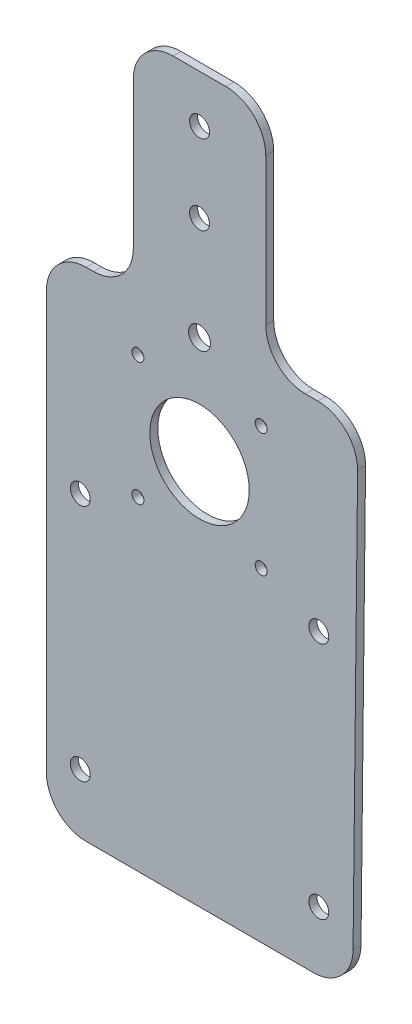
from build123d import *

# Parameters (mm, degrees)
SKETCH1_W           = 117
SKETCH1_H           = 200
BOSS_EXTRUDE1_DEPTH = 2
CUT_EXTRUDE1_DEPTH  = 2
SKETCH3_R           = 2.5
SKETCH3_R_2         = 1.5
SKETCH3_R_3         = 12.5
SKETCH3_R_4         = 2.75
CUT_EXTRUDE2_DEPTH  = 30
FILLET1_R           = 20
CUT_EXTRUDE3_DEPTH  = 10
FILLET2_R           = 10
CUT_EXTRUDE4_DEPTH  = 10
FILLET3_R           = 10
CUT_EXTRUDE5_DEPTH  = 10
FILLET4_R           = 10


with BuildPart() as part:
    # Sketch1 → Boss-Extrude1 (new body)
    with BuildSketch(Plane.XY):
        with Locations((58.5, 100)):
            Rectangle(SKETCH1_W, SKETCH1_H)
    extrude(amount=BOSS_EXTRUDE1_DEPTH)

    # Sketch2 → Cut-Extrude1 (cut)
    with BuildSketch(Plane.XY.offset(2)):
        Polygon((0, 120), (40, 200), (0, 200), align=None)
        Polygon((77, 200), (117, 120), (117, 200), align=None)
    extrude(amount=-CUT_EXTRUDE1_DEPTH, mode=Mode.SUBTRACT)

    # Sketch3 → Cut-Extrude2 (cut)
    with BuildSketch(Plane.XY.offset(2)):
        with Locations((58.5, 170)):
            Circle(SKETCH3_R)
        with Locations((58.5, 150)):
            Circle(SKETCH3_R)
        with Locations((28.5, 15)):
            Circle(SKETCH3_R)
        with Locations((88.5, 15)):
            Circle(SKETCH3_R)
        with Locations((28.5, 75)):
            Circle(SKETCH3_R)
        with Locations((88.5, 75)):
            Circle(SKETCH3_R)
        with Locations((43, 112.5)):
            Circle(SKETCH3_R_2)
        with Locations((43, 81.5)):
            Circle(SKETCH3_R_2)
        with Locations((74, 81.5)):
            Circle(SKETCH3_R_2)
        with Locations((74, 112.5)):
            Circle(SKETCH3_R_2)
        with Locations((58.5, 97)):
            Circle(SKETCH3_R_3)
        with Locations((58.5, 124)):
            Circle(SKETCH3_R_4)
    extrude(amount=-CUT_EXTRUDE2_DEPTH, mode=Mode.SUBTRACT)

    # Fillet1
    fillet1_edges = [part.edges().sort_by_distance(p)[0] for p in [
        (0, 120, 1),
        (40, 200, 1),
        (117, 120, 1),
        (77, 200, 1),
        (117, 0, 1),
        (0, 0, 1),
    ]]
    fillet(fillet1_edges, radius=FILLET1_R)

    # Sketch4 → Cut-Extrude3 (cut)
    with BuildSketch(Plane(origin=(0, 0, 0), x_dir=(-1, 0, 0), z_dir=(0, 0, -1))):
        with BuildLine():
            Line((-97, 0), (-98.708203932, 156.583592135))
            Line((-98.708203932, 156.583592135), (-114.88854382, 124.22291236))
            ThreePointArc((-114.88854382, 124.22291236), (-116.464979789, 119.873698861), (-117, 115.27864045))
            Line((-117, 115.27864045), (-117, 20))
            ThreePointArc((-117, 20), (-111.142135624, 5.857864376), (-97, 0))
        make_face()
        with BuildLine():
            Line((-20, 0), (-20, 160))
            Line((-20, 160), (-18.291796068, 156.583592135))
            Line((-18.291796068, 156.583592135), (-2.11145618, 124.22291236))
            ThreePointArc((-2.11145618, 124.22291236), (-0.535020211, 119.873698861), (0, 115.27864045))
            Line((0, 115.27864045), (0, 20))
            ThreePointArc((0, 20), (-5.857864376, 5.857864376), (-20, 0))
        make_face()
    extrude(amount=-CUT_EXTRUDE3_DEPTH, mode=Mode.SUBTRACT)

    # Fillet2
    fillet2_edges = [part.edges().sort_by_distance(p)[0] for p in [
        (97, 0, 1),
        (20, 0, 1),
        (98.708203932, 156.583592135, 1),
        (20, 160, 1),
    ]]
    fillet(fillet2_edges, radius=FILLET2_R)

    # Sketch5 → Cut-Extrude4 (cut)
    with BuildSketch(Plane(origin=(0, 0, 0), x_dir=(-1, 0, 0), z_dir=(0, 0, -1))):
        with BuildLine():
            Line((-75.153942467, 125.055763262), (-75.153942467, 197.013016167))
            ThreePointArc((-75.153942467, 197.013016167), (-79.402826552, 193.49217851), (-82.527864045, 188.94427191))
            Line((-82.527864045, 188.94427191), (-97.626690246, 158.746619509))
            ThreePointArc((-97.626690246, 158.746619509), (-98.427295018, 156.518894044), (-98.681823334, 154.165397904))
            Line((-98.681823334, 154.165397904), (-98.364260097, 125.055763262))
            Line((-98.364260097, 125.055763262), (-75.153942467, 125.055763262))
        make_face()
        with BuildLine():
            ThreePointArc((-34.472135955, 188.94427191), (-37.597173448, 193.49217851), (-41.846057533, 197.013016167))
            Line((-41.846057533, 197.013016167), (-41.846057533, 125.055763262))
            Line((-41.846057533, 125.055763262), (-20, 125.055763262))
            Line((-20, 125.055763262), (-20, 157.639320225))
            ThreePointArc((-20, 157.639320225), (-20.267510105, 159.93684943), (-21.05572809, 162.11145618))
            Line((-21.05572809, 162.11145618), (-34.472135955, 188.94427191))
        make_face()
    extrude(amount=-CUT_EXTRUDE4_DEPTH, mode=Mode.SUBTRACT)

    # Fillet3
    fillet3_edges = [part.edges().sort_by_distance(p)[0] for p in [
        (75.153942467, 197.013016167, 1),
        (41.846057533, 197.013016167, 1),
        (75.153942467, 125.055763262, 1),
        (98.364260097, 125.055763262, 1),
        (41.846057533, 125.055763262, 1),
        (20, 125.055763262, 1),
    ]]
    fillet(fillet3_edges, radius=FILLET3_R)

    # Sketch6 → Cut-Extrude5 (cut)
    with BuildSketch(Plane(origin=(0, 0, 0), x_dir=(-1, 0, 0), z_dir=(0, 0, -1))):
        with BuildLine():
            Line((-75.153942467, 189.986749418), (-75.153942467, 182))
            Line((-75.153942467, 182), (-41.846057533, 182))
            Line((-41.846057533, 182), (-41.846057533, 189.986749418))
            ThreePointArc((-41.846057533, 189.986749418), (-44.595325762, 196.873467707), (-51.33143529, 199.973498837))
            ThreePointArc((-51.33143529, 199.973498837), (-51.845886972, 199.993373612), (-52.360679775, 200))
            Line((-52.360679775, 200), (-64.639320225, 200))
            ThreePointArc((-64.639320225, 200), (-65.154113028, 199.993373612), (-65.66856471, 199.973498837))
            ThreePointArc((-65.66856471, 199.973498837), (-72.404674238, 196.873467707), (-75.153942467, 189.986749418))
        make_face()
    extrude(amount=-CUT_EXTRUDE5_DEPTH, mode=Mode.SUBTRACT)

    # Fillet4
    fillet4_edges = [part.edges().sort_by_distance(p)[0] for p in [
        (41.846057533, 182, 1),
        (75.153942467, 182, 1),
    ]]
    fillet(fillet4_edges, radius=FILLET4_R)


solid = part.part
